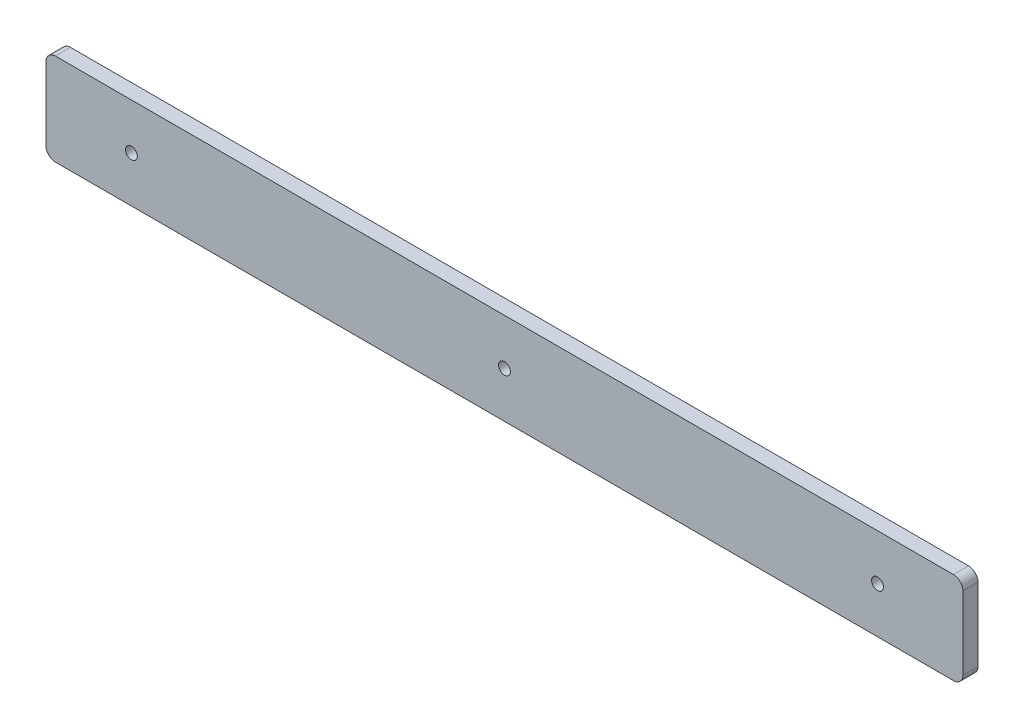
from build123d import *

# Parameters (mm, degrees)
SKETCH1_W           = 97.398000022
SKETCH1_H           = 9.757695242
BOSS_EXTRUDE1_DEPTH = 1.6002
SKETCH2_R           = 0.625
CUT_EXTRUDE1_DEPTH  = 98.898639749
FILLET1_R           = 1


with BuildPart() as part:
    # Sketch1 → Boss-Extrude1 (new body)
    with BuildSketch(Plane.XY):
        with Locations((48.699000011, 4.878847621)):
            Rectangle(SKETCH1_W, SKETCH1_H)
    extrude(amount=BOSS_EXTRUDE1_DEPTH)

    # Sketch2 → Cut-Extrude1 (cut, through all)
    with BuildSketch(Plane.XY.offset(1.6002)):
        with Locations((9.074999884, 4.878847621)):
            Circle(SKETCH2_R)
        with Locations((48.698999884, 4.878847621)):
            Circle(SKETCH2_R)
        with Locations((88.323000138, 4.878847621)):
            Circle(SKETCH2_R)
    extrude(amount=-CUT_EXTRUDE1_DEPTH, mode=Mode.SUBTRACT)

    # Fillet1
    fillet1_edges = [part.edges().sort_by_distance(p)[0] for p in [
        (0, 0, 0.8001),
        (97.398000022, 0, 0.8001),
        (97.398000022, 9.757695242, 0.8001),
        (0, 9.757695242, 0.8001),
    ]]
    fillet(fillet1_edges, radius=FILLET1_R)


solid = part.part
